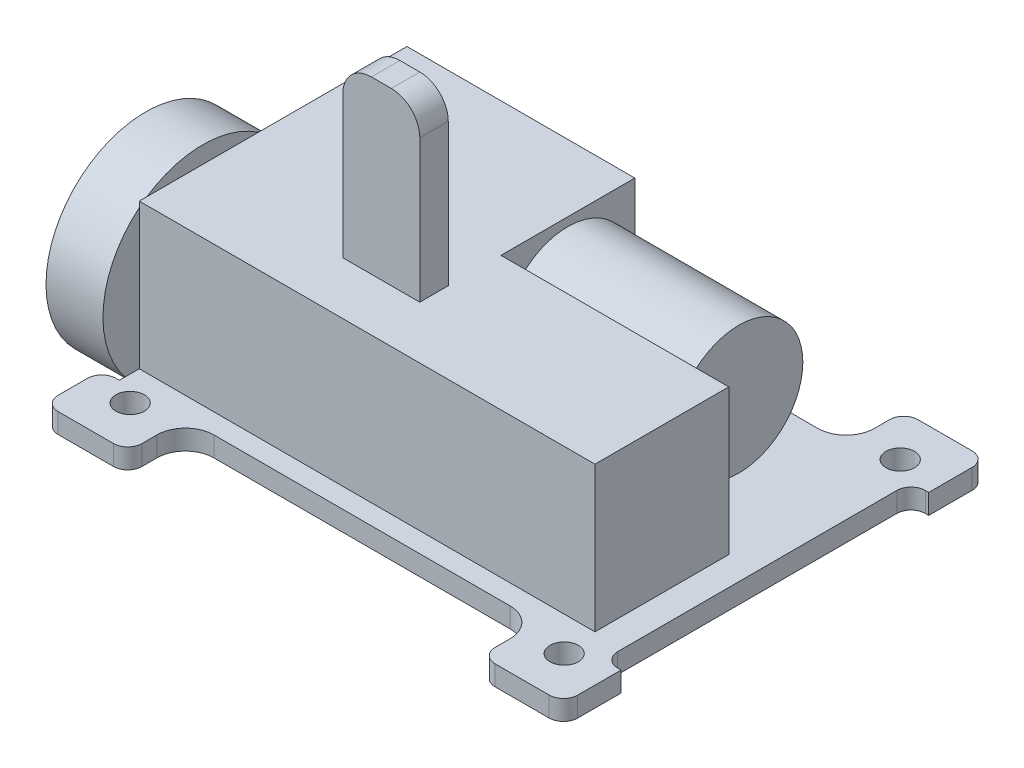
from build123d import *

# Parameters (mm, degrees)
SKETCH1_R            = 0.5
BOSS_EXTRUDE1_DEPTH  = 0.7
FILLET1_R            = 1
FILLET2_R            = 0.5
BOSS_EXTRUDE2_DEPTH  = 5.1
SKETCH3_R            = 2.25
BOSS_EXTRUDE7_DEPTH  = 6
SKETCH4_W            = 5
SKETCH4_H            = 5
BOSS_EXTRUDE8_DEPTH  = 1
SKETCH5_R            = 3.5
BOSS_EXTRUDE9_DEPTH  = 2
SKETCH6_W            = 2.7
SKETCH6_H            = 1
BOSS_EXTRUDE10_DEPTH = 6
FILLET3_R            = 1


with BuildPart() as part:
    # Sketch1 → Boss-Extrude1 (new body)
    with BuildSketch(Plane(origin=(0, 0, 0), x_dir=(1, 0, 0), z_dir=(0, 1, 0))):
        Polygon((0, 0), (2.94, 0), (2.94, 2.025), (15.34, 2.025), (15.34, 0), (18.24, 0), (18.24, 2.025), (17.62, 2.025), (17.62, 12.825), (18.24, 12.825), (18.24, 14.85), (15.34, 14.85), (15.34, 12.825), (2.94, 12.825), (2.94, 14.85), (0, 14.85), (0, 12.825), (0.62, 12.825), (0.62, 2.025), (0, 2.025), align=None)
        with Locations(Location((1.5, 13.325, 0), (0, 0, 270))):
            Circle(SKETCH1_R, mode=Mode.SUBTRACT)
        with Locations(Location((1.5, 1.525, 0), (0, 0, 270))):
            Circle(SKETCH1_R, mode=Mode.SUBTRACT)
        with Locations(Location((16.74, 1.525, 0), (0, 0, 270))):
            Circle(SKETCH1_R, mode=Mode.SUBTRACT)
        with Locations(Location((16.74, 13.325, 0), (0, 0, 270))):
            Circle(SKETCH1_R, mode=Mode.SUBTRACT)
    extrude(amount=BOSS_EXTRUDE1_DEPTH)

    # Fillet1
    fillet1_edges = [part.edges().sort_by_distance(p)[0] for p in [
        (2.94, 0.35, -12.825),
        (15.34, 0.35, -12.825),
        (15.34, 0.35, -2.025),
        (2.94, 0.35, -2.025),
    ]]
    fillet(fillet1_edges, radius=FILLET1_R)

    # Fillet2
    fillet2_edges = [part.edges().sort_by_distance(p)[0] for p in [
        (0, 0.35, -2.025),
        (0.62, 0.35, -12.825),
        (0, 0.35, -14.85),
        (2.94, 0.35, -14.85),
        (15.34, 0.35, -14.85),
        (18.24, 0.35, -14.85),
        (17.62, 0.35, -12.825),
        (17.62, 0.35, -2.025),
        (18.24, 0.35, 0),
        (15.34, 0.35, 0),
        (2.94, 0.35, 0),
        (0, 0.35, 0),
    ]]
    fillet(fillet2_edges, radius=FILLET2_R)

    # Sketch2 → Boss-Extrude2 (add)
    with BuildSketch(Plane(origin=(0, 0.7, 0), x_dir=(1, 0, 0), z_dir=(0, 1, 0))):
        Polygon((0.62, 2.725), (16.62, 2.725), (16.62, 7.425), (8.62, 7.425), (8.62, 12.125), (0.62, 12.125), align=None)
    extrude(amount=BOSS_EXTRUDE2_DEPTH)

    # Sketch3 → Boss-Extrude7 (add)
    with BuildSketch(Plane(origin=(8.62, 0, 0), x_dir=(0, 0, -1), z_dir=(1, 0, 0))):
        with Locations(Location((9.775, 3.25, 0), (0, 0, 180))):
            Circle(SKETCH3_R)
    extrude(amount=BOSS_EXTRUDE7_DEPTH)

    # Sketch4 → Boss-Extrude8 (add)
    with BuildSketch(Plane.XZ):
        with Locations((9.14, -7.175)):
            Rectangle(SKETCH4_W, SKETCH4_H)
    extrude(amount=BOSS_EXTRUDE8_DEPTH)

    # Sketch5 → Boss-Extrude9 (add)
    with BuildSketch(Plane.ZY.offset(-0.62)):
        with Locations(Location((-4.95, 2.9, 0), (0, 0, 124.04773237))):
            Circle(SKETCH5_R)
    extrude(amount=BOSS_EXTRUDE9_DEPTH)

    # Sketch6 → Boss-Extrude10 (add)
    with BuildSketch(Plane(origin=(0, 5.8, 0), x_dir=(1, 0, 0), z_dir=(0, 1, 0))):
        with Locations((7.27, 5.075)):
            Rectangle(SKETCH6_W, SKETCH6_H)
    extrude(amount=BOSS_EXTRUDE10_DEPTH)

    # Fillet3
    fillet3_edges = [part.edges().sort_by_distance(p)[0] for p in [
        (5.92, 11.8, -5.075),
        (8.62, 11.8, -5.075),
    ]]
    fillet(fillet3_edges, radius=FILLET3_R)


solid = part.part
